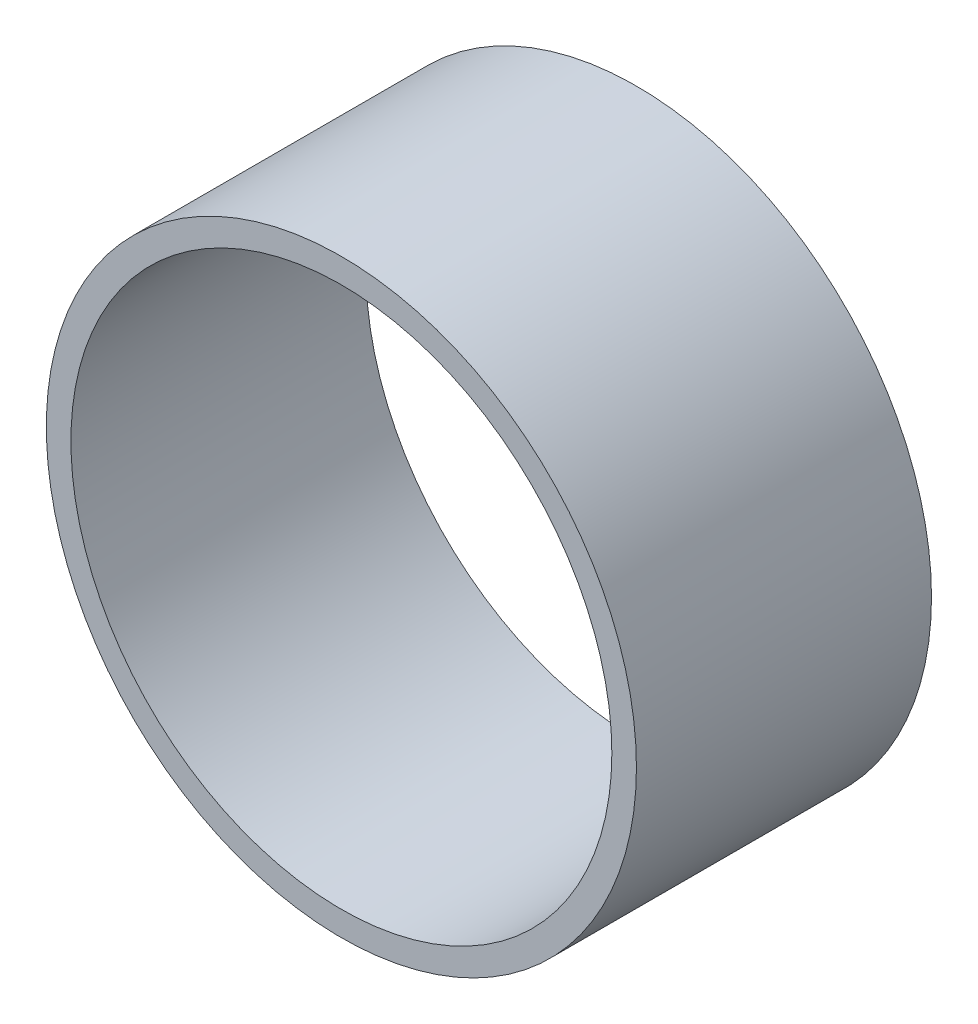
from build123d import *

# Parameters (mm, degrees)
ESQUISSE1_R        = 12
ESQUISSE1_R_2      = 11
BOSS_EXTRU_1_DEPTH = 12


with BuildPart() as part:
    # Esquisse1 → Boss.-Extru.1 (new body)
    with BuildSketch(Plane.XY):
        Circle(ESQUISSE1_R)
        Circle(ESQUISSE1_R_2, mode=Mode.SUBTRACT)
    extrude(amount=BOSS_EXTRU_1_DEPTH)


solid = part.part
